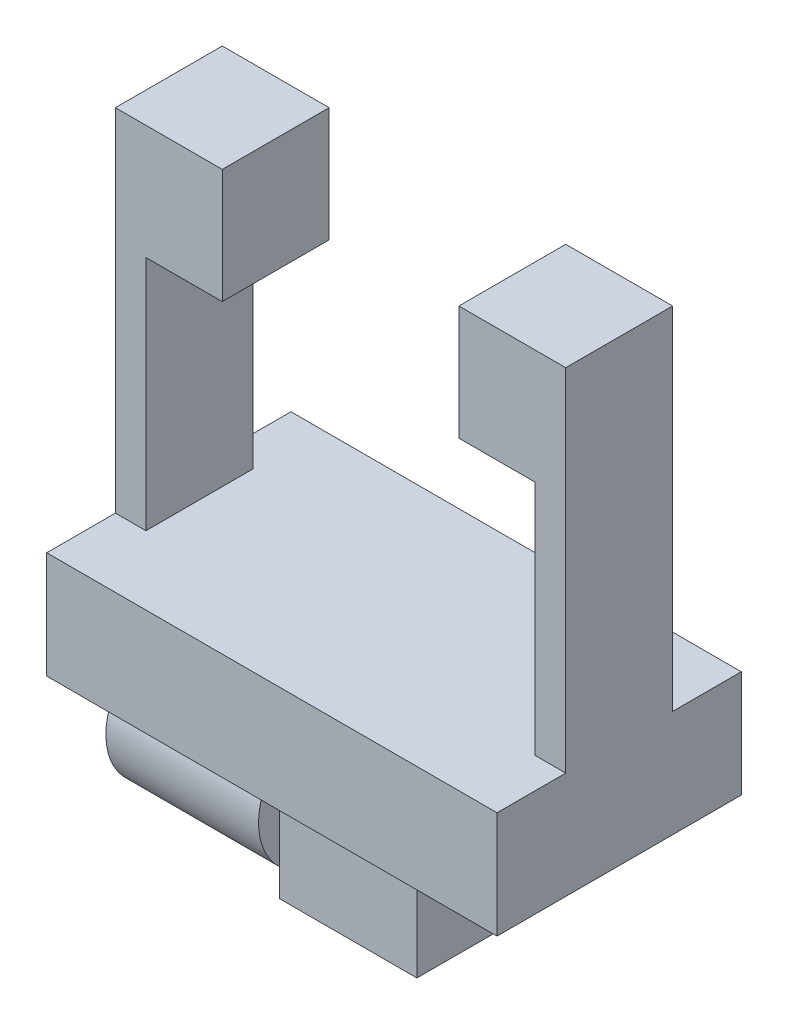
from build123d import *

# Parameters (mm, degrees)
SKETCH1_W           = 74.93
SKETCH1_H           = 17.78
BOSS_EXTRUDE1_DEPTH = 20.32
SKETCH2_W           = 5.08
SKETCH2_H           = 39.37
BOSS_EXTRUDE2_DEPTH = 8.89
SKETCH3_W           = 17.78
SKETCH3_H           = 19.05
BOSS_EXTRUDE3_DEPTH = 8.89
SKETCH5_W           = 22.86
SKETCH5_H           = 25.4
BOSS_EXTRUDE4_DEPTH = 7.62
SKETCH6_R           = 11.1125
BOSS_EXTRUDE5_DEPTH = 25.4


with BuildPart() as part:
    # Sketch1 → Boss-Extrude1 (new, symmetric)
    with BuildSketch(Plane.XY):
        Rectangle(SKETCH1_W, SKETCH1_H)
    extrude(amount=BOSS_EXTRUDE1_DEPTH, both=True)

    # Sketch2 → Boss-Extrude2 (add, symmetric)
    with BuildSketch(Plane.XY):
        with Locations((-34.925, 28.575)):
            Rectangle(SKETCH2_W, SKETCH2_H)
        with Locations((34.925, 28.575)):
            Rectangle(SKETCH2_W, SKETCH2_H)
    extrude(amount=BOSS_EXTRUDE2_DEPTH, both=True)

    # Sketch3 → Boss-Extrude3 (add, symmetric)
    with BuildSketch(Plane.XY):
        with Locations((28.575, 57.785)):
            Rectangle(SKETCH3_W, SKETCH3_H)
        with Locations((-28.575, 57.785)):
            Rectangle(SKETCH3_W, SKETCH3_H)
    extrude(amount=BOSS_EXTRUDE3_DEPTH, both=True)

    # Sketch5 → Boss-Extrude4 (add, symmetric)
    with BuildSketch(Plane.XY):
        with Locations((0, -21.59)):
            Rectangle(SKETCH5_W, SKETCH5_H)
    extrude(amount=BOSS_EXTRUDE4_DEPTH, both=True)

    # Sketch6 → Boss-Extrude5 (add)
    with BuildSketch(Plane.ZY.offset(11.43)):
        with Locations(Location((0, -21.59, 0), (0, 0, 46.708192407))):
            Circle(SKETCH6_R)
    extrude(amount=BOSS_EXTRUDE5_DEPTH)


solid = part.part
